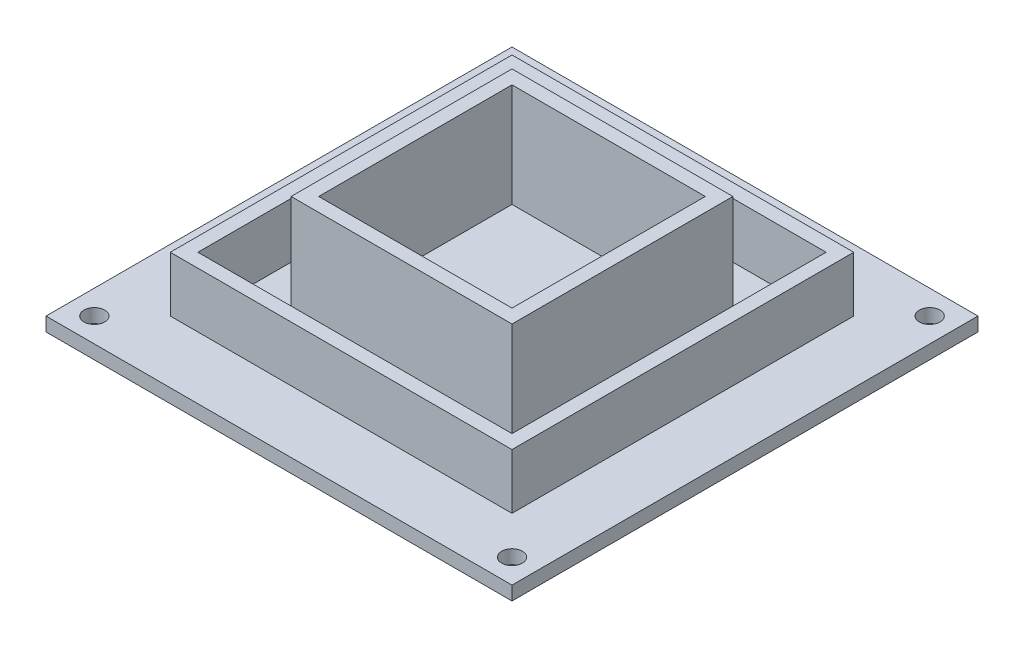
from build123d import *

# Parameters (mm, degrees)
SKETCH2_W           = 67.5
SKETCH2_H           = 67.5
SKETCH2_R           = 1.5
BOSS_EXTRUDE3_DEPTH = 2
SKETCH1_W           = 32
SKETCH1_H           = 32
SKETCH1_W_2         = 28
SKETCH1_H_2         = 28
BOSS_EXTRUDE4_DEPTH = 17
SKETCH1_6_W         = 49.5
SKETCH1_6_H         = 49.5
SKETCH1_6_W_2       = 45.5
SKETCH1_6_H_2       = 45.5
BOSS_EXTRUDE5_DEPTH = 10


with BuildPart() as part:
    # Sketch2 → Boss-Extrude3 (new body)
    with BuildSketch(Plane(origin=(0, 0, 0), x_dir=(1, 0, 0), z_dir=(0, 1, 0))):
        with Locations((-7.30721393, -10.093283582)):
            Rectangle(SKETCH2_W, SKETCH2_H)
        with Locations((-37.55721393, -40.343283582)):
            Circle(SKETCH2_R, mode=Mode.SUBTRACT)
        with Locations((22.94278607, -40.343283582)):
            Circle(SKETCH2_R, mode=Mode.SUBTRACT)
        with Locations((-37.55721393, 20.156716418)):
            Circle(SKETCH2_R, mode=Mode.SUBTRACT)
        with Locations((22.94278607, 20.156716418)):
            Circle(SKETCH2_R, mode=Mode.SUBTRACT)
    extrude(amount=BOSS_EXTRUDE3_DEPTH)

    # Sketch1 → Boss-Extrude4 (add)
    with BuildSketch(Plane(origin=(0, 0, 0), x_dir=(1, 0, 0), z_dir=(0, 1, 0))):
        with Locations((-7.30721393, -10.093283582)):
            Rectangle(SKETCH1_W, SKETCH1_H)
        with Locations((-7.30721393, -10.093283582)):
            Rectangle(SKETCH1_W_2, SKETCH1_H_2, mode=Mode.SUBTRACT)
    extrude(amount=BOSS_EXTRUDE4_DEPTH)

    # Sketch1<6> → Boss-Extrude5 (add)
    with BuildSketch(Plane(origin=(0, 0, 0), x_dir=(1, 0, 0), z_dir=(0, 1, 0))):
        with Locations((-7.30721393, -10.093283582)):
            Rectangle(SKETCH1_6_W, SKETCH1_6_H)
        with Locations((-7.30721393, -10.093283582)):
            Rectangle(SKETCH1_6_W_2, SKETCH1_6_H_2, mode=Mode.SUBTRACT)
    extrude(amount=BOSS_EXTRUDE5_DEPTH)


solid = part.part
